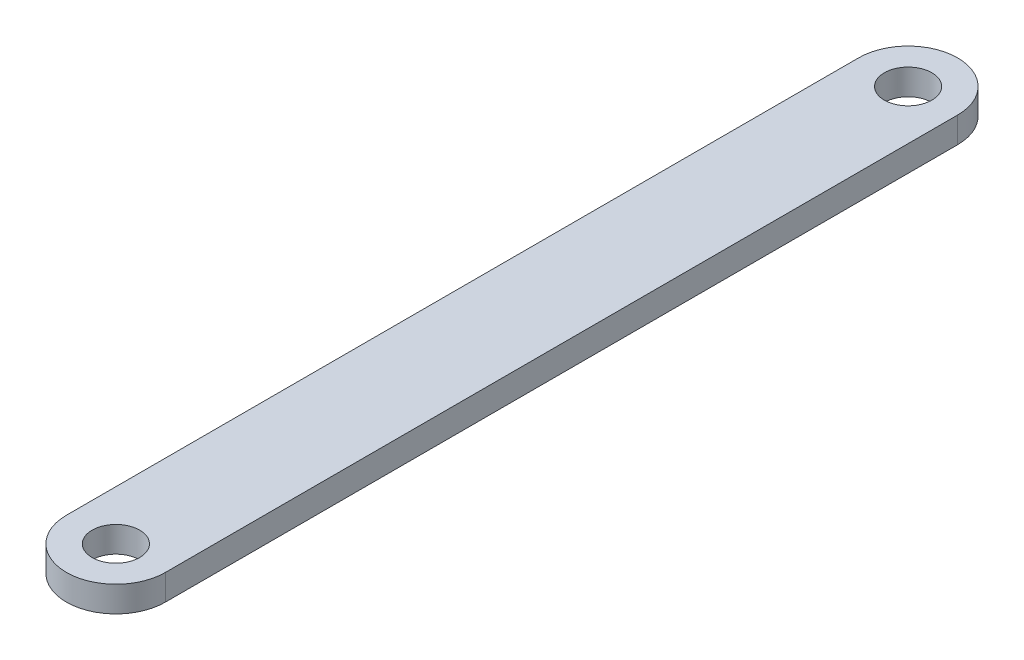
from build123d import *

# Parameters (mm, degrees)
SKETCH1_R           = 6
BOSS_EXTRUDE1_DEPTH = 3.25


with BuildPart() as part:
    # Sketch1 → Boss-Extrude1 (new, symmetric)
    with BuildSketch(Plane(origin=(0, 0, 0), x_dir=(1, 0, 0), z_dir=(0, 1, 0))):
        with BuildLine():
            Line((-12.5, 0), (-12.5, 200))
            ThreePointArc((-12.5, 200), (0, 212.5), (12.5, 200))
            Line((12.5, 200), (12.5, 0))
            ThreePointArc((12.5, 0), (0, -12.5), (-12.5, 0))
        make_face()
        with Locations(Location((0, 200, 0), (0, 0, 90))):
            Circle(SKETCH1_R, mode=Mode.SUBTRACT)
        with Locations(Location((0, 0, 0), (0, 0, 90))):
            Circle(SKETCH1_R, mode=Mode.SUBTRACT)
    extrude(amount=BOSS_EXTRUDE1_DEPTH, both=True)


solid = part.part
